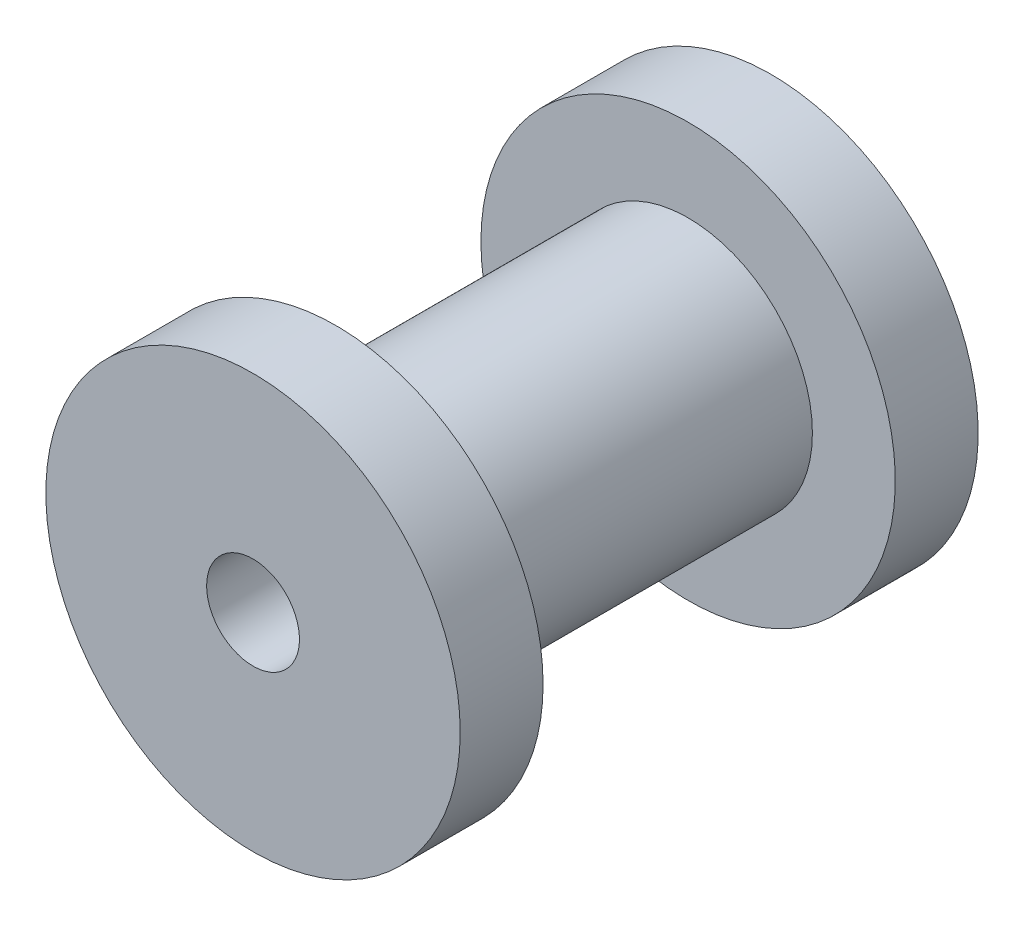
from build123d import *

# Parameters (mm, degrees)
SKETCH1_R           = 9.525
BOSS_EXTRUDE1_DEPTH = 26.9875
SKETCH2_R           = 15.875
BOSS_EXTRUDE2_DEPTH = 6.35
BOSS_EXTRUDE3_START = 6.35
SKETCH3_R           = 15.875
BOSS_EXTRUDE3_DEPTH = 6.35
SKETCH4_R           = 3.556
CUT_EXTRUDE1_DEPTH  = 46.597466007


with BuildPart() as part:
    # Sketch1 → Boss-Extrude1 (new body)
    with BuildSketch(Plane.XY):
        Circle(SKETCH1_R)
    extrude(amount=BOSS_EXTRUDE1_DEPTH)

    # Sketch2 → Boss-Extrude2 (add)
    with BuildSketch(Plane.XY.offset(26.9875)):
        Circle(SKETCH2_R)
    extrude(amount=BOSS_EXTRUDE2_DEPTH)

    # Sketch3 → Boss-Extrude3 (add)
    with BuildSketch(Plane(origin=(0, 0, 0), x_dir=(-1, 0, 0), z_dir=(0, 0, -1)).offset(BOSS_EXTRUDE3_START)):
        with Locations(Location((0, 0, 0), (0, 0, 180))):
            Circle(SKETCH3_R)
    extrude(amount=-BOSS_EXTRUDE3_DEPTH)

    # Sketch4 → Cut-Extrude1 (cut, through all)
    with BuildSketch(Plane(origin=(0, 0, -6.35), x_dir=(-1, 0, 0), z_dir=(0, 0, -1))):
        Circle(SKETCH4_R)
    extrude(amount=-CUT_EXTRUDE1_DEPTH, mode=Mode.SUBTRACT)


solid = part.part
